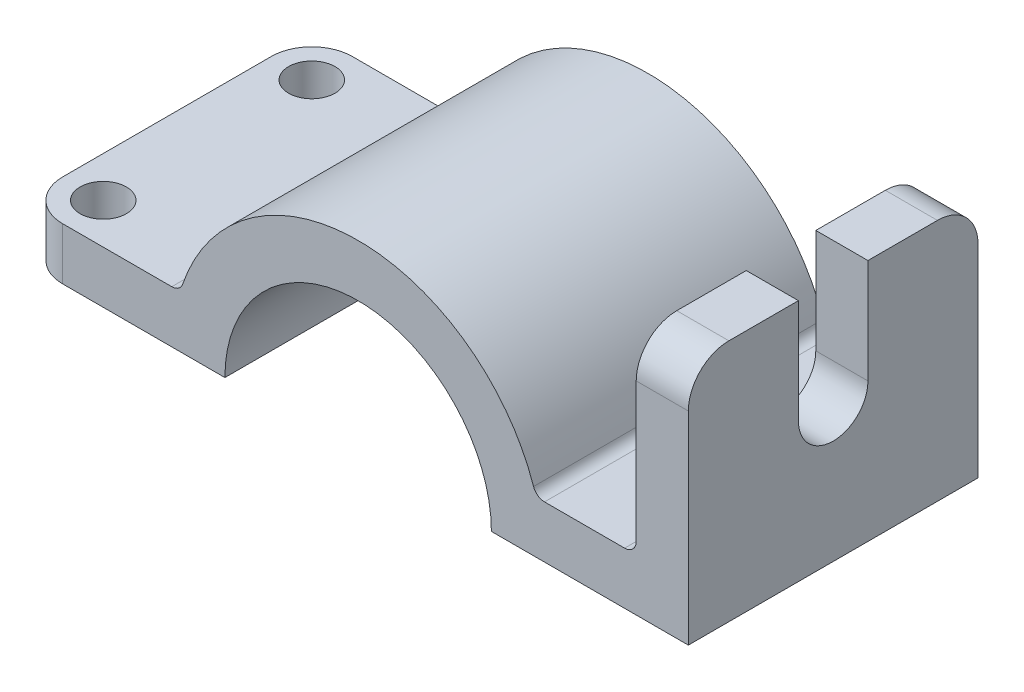
from build123d import *

# Parameters (mm, degrees)
BOSS_EXTRUDE1_DEPTH = 25
CUT_EXTRUDE1_REACH  = 126.956
FILLET1_R           = 7
FILLET2_R           = 7
CUT_EXTRUDE2_REACH  = 73.26
SKETCH3_R           = 4


with BuildPart() as part:
    # Sketch1 → Boss-Extrude1 (new, symmetric)
    with BuildSketch(Plane.XY):
        with BuildLine():
            Line((-58, 0), (-23, 0))
            ThreePointArc((-23, 0), (0, 23), (23, 0))
            Line((23, 0), (57, 0))
            Line((57, 0), (57, 42))
            Line((57, 42), (48, 42))
            Line((48, 42), (48, 11))
            ThreePointArc((48, 11), (47.414213562, 9.585786438), (46, 9))
            Line((46, 9), (32.171415884, 9))
            ThreePointArc((32.171415884, 9), (31.008255888, 9.373021566), (30.278979656, 10.352941176))
            ThreePointArc((30.278979656, 10.352941176), (0, 32), (-30.278979656, 10.352941176))
            ThreePointArc((-30.278979656, 10.352941176), (-31.008255888, 9.373021566), (-32.171415884, 9))
            Line((-32.171415884, 9), (-58, 9))
            Line((-58, 9), (-58, 0))
        make_face()
    extrude(amount=BOSS_EXTRUDE1_DEPTH, both=True)

    # Sketch2 → Cut-Extrude1 (cut, up to next)
    with BuildSketch(Plane(origin=(57, 0, 0), x_dir=(0, 0, -1), z_dir=(1, 0, 0)), mode=Mode.PRIVATE) as cut_extrude1_sk1:
        with BuildLine():
            Line((-6, 24), (-6, 42))
            ThreePointArc((-6, 42), (0, 48), (6, 42))
            Line((6, 42), (6, 24))
            ThreePointArc((6, 24), (0, 18), (-6, 24))
        make_face()
    cut_extrude1_tool1 = extrude(cut_extrude1_sk1.sketch, amount=-CUT_EXTRUDE1_REACH, mode=Mode.PRIVATE) & part.part
    add(cut_extrude1_tool1.solids().sort_by_distance((57, 33, 0))[0], mode=Mode.SUBTRACT)

    # Fillet1
    fillet1_edges = [part.edges().sort_by_distance(p)[0] for p in [
        (52.5, 42, -25),
        (52.5, 42, 25),
    ]]
    fillet(fillet1_edges, radius=FILLET1_R)

    # Fillet2
    fillet2_edges = [part.edges().sort_by_distance(p)[0] for p in [
        (-58, 4.5, -25),
        (-58, 4.5, 25),
    ]]
    fillet(fillet2_edges, radius=FILLET2_R)

    # Sketch3 → Cut-Extrude2 (cut, up to next)
    with BuildSketch(Plane(origin=(0, 9, 0), x_dir=(1, 0, 0), z_dir=(0, 1, 0)), mode=Mode.PRIVATE) as cut_extrude2_sk1:
        with Locations(Location((-51, 18, 0), (0, 0, 180))):
            Circle(SKETCH3_R)
    cut_extrude2_tool1 = extrude(cut_extrude2_sk1.sketch, amount=-CUT_EXTRUDE2_REACH, mode=Mode.PRIVATE) & part.part
    # Sketch3 → Cut-Extrude2 (cut, up to next)
    with BuildSketch(Plane(origin=(0, 9, 0), x_dir=(1, 0, 0), z_dir=(0, 1, 0)), mode=Mode.PRIVATE) as cut_extrude2_sk2:
        with Locations(Location((-51, -18, 0), (0, 0, 180))):
            Circle(SKETCH3_R)
    cut_extrude2_tool2 = extrude(cut_extrude2_sk2.sketch, amount=-CUT_EXTRUDE2_REACH, mode=Mode.PRIVATE) & part.part
    add(cut_extrude2_tool1.solids().sort_by_distance((-51, 9, -18))[0], mode=Mode.SUBTRACT)
    add(cut_extrude2_tool2.solids().sort_by_distance((-51, 9, 18))[0], mode=Mode.SUBTRACT)


solid = part.part
